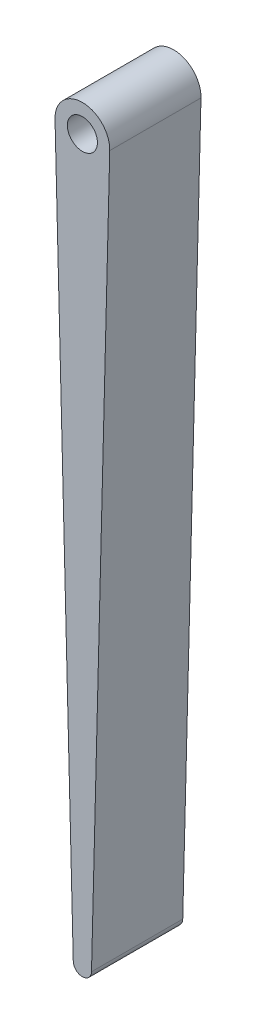
from build123d import *

# Parameters (mm, degrees)
SKETCH_1_R      = 3.3
EXTRUDE_1_DEPTH = 20


with BuildPart() as part:
    # 草图1 → 凸台-拉伸1 (new body)
    with BuildSketch(Plane.XY):
        with BuildLine():
            Line((-5.998076923, -0.151898734), (-1.999358974, -158.050632911))
            ThreePointArc((-1.999358974, -158.050632911), (0, -160), (1.999358974, -158.050632911))
            Line((1.999358974, -158.050632911), (5.998076923, -0.151898734))
            ThreePointArc((5.998076923, -0.151898734), (0, 6), (-5.998076923, -0.151898734))
        make_face()
        Circle(SKETCH_1_R, mode=Mode.SUBTRACT)
    extrude(amount=EXTRUDE_1_DEPTH)


solid = part.part
